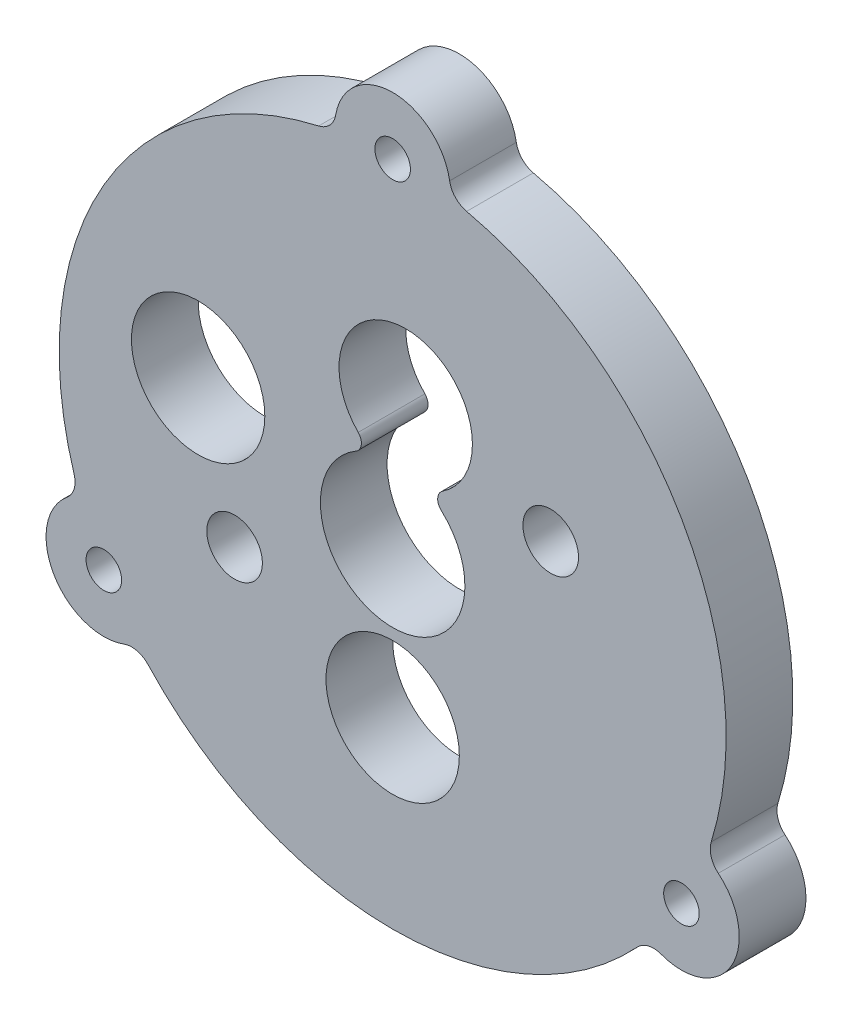
from build123d import *

# Parameters (mm, degrees)
SKETCH_1_R      = 3
SKETCH_1_R_2    = 0.8
SKETCH_1_R_3    = 1.25
EXTRUDE_1_DEPTH = 3
FILLET_1_R      = 0.5
FILLET_2_R      = 1


with BuildPart() as part:
    # ｽｹｯﾁ1 → ﾎﾞｽ - 押し出し1 (new body)
    with BuildSketch(Plane.XY):
        with BuildLine():
            ThreePointArc((-11.50012809, -9.630527187), (-15.242047107, -8.8), (-14.090345241, -5.144139479))
            ThreePointArc((-14.090345241, -5.144139479), (-12.990381057, 7.5), (-2.590217151, 14.774666667))
            ThreePointArc((-2.590217151, 14.774666667), (0, 17.6), (2.590217151, 14.774666667))
            ThreePointArc((2.590217151, 14.774666667), (12.990381057, 7.5), (14.090345241, -5.144139479))
            ThreePointArc((14.090345241, -5.144139479), (15.242047107, -8.8), (11.50012809, -9.630527187))
            ThreePointArc((11.50012809, -9.630527187), (0, -15), (-11.50012809, -9.630527187))
        make_face()
        with Locations((-8.749968889, 2.106666667)):
            Circle(SKETCH_1_R, mode=Mode.SUBTRACT)
        with Locations((0, -6.75)):
            Circle(SKETCH_1_R, mode=Mode.SUBTRACT)
        with Locations((0, 15)):
            Circle(SKETCH_1_R_2, mode=Mode.SUBTRACT)
        with Locations((12.990381057, -7.5)):
            Circle(SKETCH_1_R_2, mode=Mode.SUBTRACT)
        with Locations((-12.990381057, -7.5)):
            Circle(SKETCH_1_R_2, mode=Mode.SUBTRACT)
        with Locations((-7.109225892, -3.668638333)):
            Circle(SKETCH_1_R_3, mode=Mode.SUBTRACT)
        with Locations((7.109225892, 3.668638333)):
            Circle(SKETCH_1_R_3, mode=Mode.SUBTRACT)
        with BuildLine():
            ThreePointArc((1.563335837, 2.849294836), (0.895749756, 8.670249526), (-0.94779451, 3.108727323))
            ThreePointArc((-0.94779451, 3.108727323), (-0.333989648, -3.232793052), (1.563335837, 2.849294836))
        make_face(mode=Mode.SUBTRACT)
    extrude(amount=EXTRUDE_1_DEPTH)

    # ﾌｨﾚｯﾄ1
    fillet_1_edges = [part.edges().sort_by_distance(p)[0] for p in [
        (-0.94779451, 3.108727323, 1.5),
        (1.563335837, 2.849294836, 1.5),
    ]]
    fillet(fillet_1_edges, radius=FILLET_1_R)

    # ﾌｨﾚｯﾄ2
    fillet_2_edges = [part.edges().sort_by_distance(p)[0] for p in [
        (-11.50012809, -9.630527187, 1.5),
        (-14.090345241, -5.144139479, 1.5),
        (-2.590217151, 14.774666667, 1.5),
        (2.590217151, 14.774666667, 1.5),
        (14.090345241, -5.144139479, 1.5),
        (11.50012809, -9.630527187, 1.5),
    ]]
    fillet(fillet_2_edges, radius=FILLET_2_R)


solid = part.part
